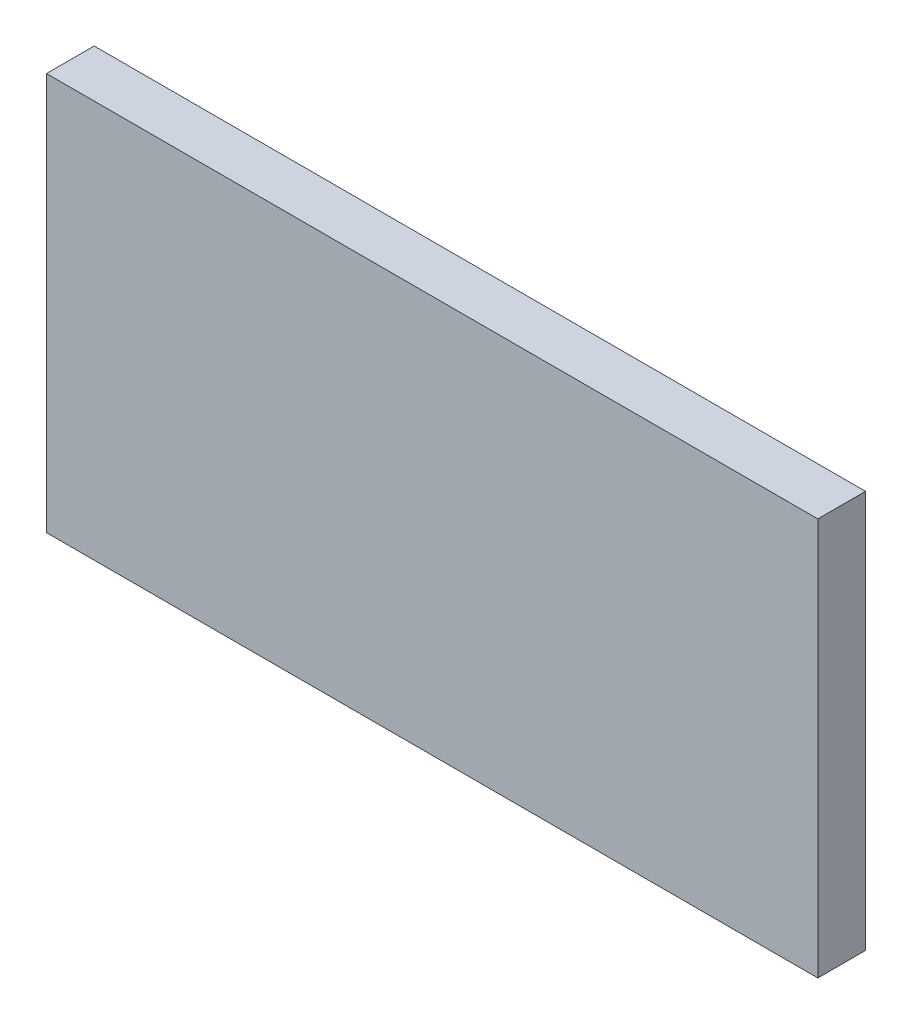
from build123d import *

# Parameters (mm, degrees)
SKETCH_1_W      = 97
SKETCH_1_H      = 50
EXTRUDE_1_DEPTH = 6


with BuildPart() as part:
    # Эскиз1 → Бобышка-Вытянуть1 (new body)
    with BuildSketch(Plane.XY):
        Rectangle(SKETCH_1_W, SKETCH_1_H)
    extrude(amount=EXTRUDE_1_DEPTH)


solid = part.part
